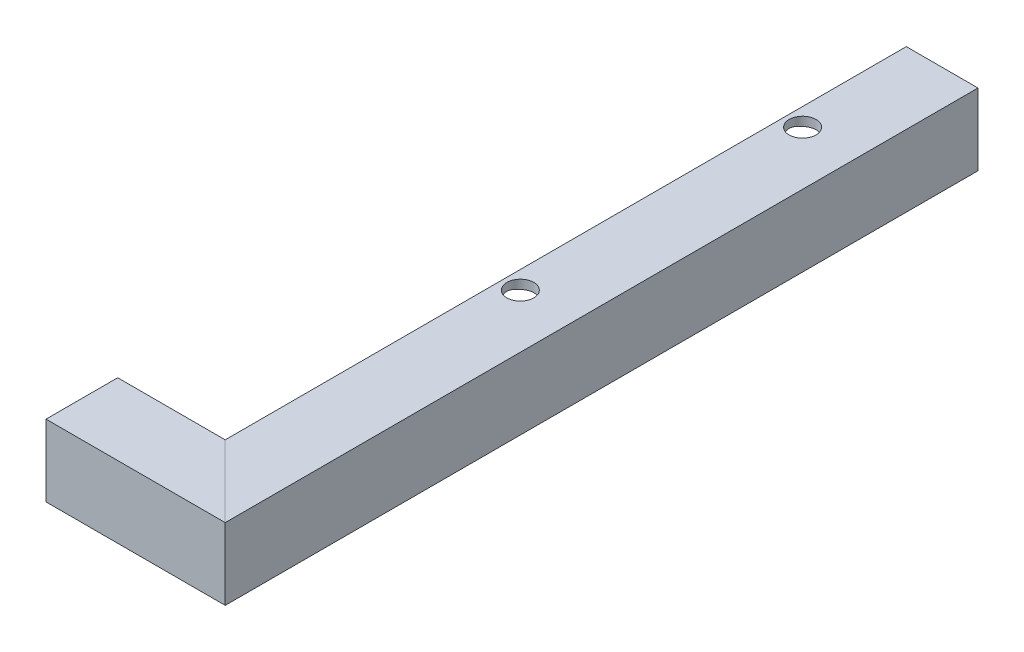
from build123d import *

# Parameters (mm, degrees)
HIERRO_ANGULAR_2_X_2_X_0_125_1_DEPTH   = 199.842048969
HIERRO_ANGULAR_2_X_2_X_0_125_1_2_DEPTH = 606.242048969
CROQUIS6_R                             = 9.525
CORTAR_EXTRUIR1_DEPTH                  = 551.658878072


with BuildPart() as part:
    # Sketch1 → Hierro angular 2 X 2 X 0.125(1) (new body)
    with BuildSketch(Plane(origin=(0, 0, 0), x_dir=(0, -1, 0), z_dir=(1, 0, 0))):
        with BuildLine():
            Line((0, 0), (0, 50.8))
            Line((0, 50.8), (0.00508, 50.8))
            ThreePointArc((0.00508, 50.8), (4.491615958, 48.941615958), (6.35, 44.45508))
            Line((6.35, 44.45508), (6.35, 11.1125))
            ThreePointArc((6.35, 11.1125), (7.744903955, 7.744903955), (11.1125, 6.35))
            Line((11.1125, 6.35), (44.45508, 6.35))
            ThreePointArc((44.45508, 6.35), (48.941615958, 4.491615958), (50.8, 0.00508))
            Line((50.8, 0.00508), (50.8, 0))
            Line((50.8, 0), (0, 0))
        make_face()
    extrude(amount=HIERRO_ANGULAR_2_X_2_X_0_125_1_DEPTH)

    # Hierro angular 2 X 2 X 0.125(1) mitre 1
    split(bisect_by=Plane(origin=(127, 0, 0), x_dir=(0, -1, 0), z_dir=(-0.707106781, 0, 0.707106781)), keep=Keep.TOP)


with BuildPart() as body_2:
    # Sketch1 on segment 2 (carried to segment 2) → Hierro angular 2 X 2 X 0.125_1 2 (new body)
    with BuildSketch(Plane(origin=(127, 0, 72.842048969), x_dir=(0, -1, 0), z_dir=(0, 0, -1))):
        with BuildLine():
            Line((0, 0), (0, 50.8))
            Line((0, 50.8), (0.00508, 50.8))
            ThreePointArc((0.00508, 50.8), (4.491615958, 48.941615958), (6.35, 44.45508))
            Line((6.35, 44.45508), (6.35, 11.1125))
            ThreePointArc((6.35, 11.1125), (7.744903955, 7.744903955), (11.1125, 6.35))
            Line((11.1125, 6.35), (44.45508, 6.35))
            ThreePointArc((44.45508, 6.35), (48.941615958, 4.491615958), (50.8, 0.00508))
            Line((50.8, 0.00508), (50.8, 0))
            Line((50.8, 0), (0, 0))
        make_face()
    extrude(amount=HIERRO_ANGULAR_2_X_2_X_0_125_1_2_DEPTH)

    # Hierro angular 2 X 2 X 0.125_1 2 mitre 1
    split(bisect_by=Plane(origin=(127, 0, 0), x_dir=(0, 1, 0), z_dir=(0.707106781, 0, -0.707106781)), keep=Keep.TOP)

    # Croquis6 → Cortar-Extruir1 (cut, through all)
    with BuildSketch(Plane(origin=(0, 0, 0), x_dir=(1, 0, 0), z_dir=(0, 1, 0))):
        with Locations(Location((88.9, 447.2, 0), (0, 0, 180))):
            Circle(CROQUIS6_R)
        with Locations(Location((88.9, 247.2, 0), (0, 0, 180))):
            Circle(CROQUIS6_R)
    extrude(amount=-CORTAR_EXTRUIR1_DEPTH, mode=Mode.SUBTRACT)


solid = Compound([part.part, body_2.part])
